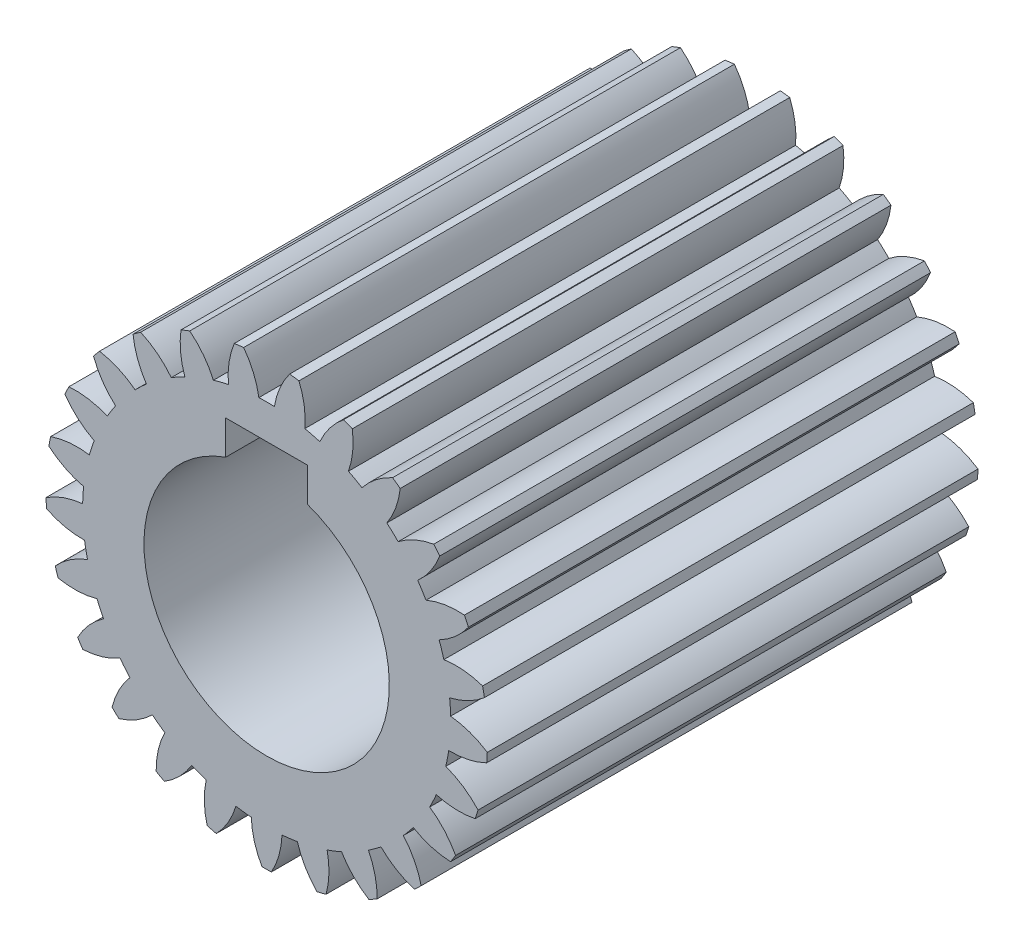
from build123d import *

# Parameters (mm, degrees)
EXTRUDE_1_DEPTH = 60


with BuildPart() as part:
    # Model → 凸台-拉伸1 (new body)
    with BuildSketch(Plane.XY):
        with BuildLine():
            ThreePointArc((-26.623667603, 4.492251481), (-24.628342026, 3.167806143), (-22.375329871, 2.355761908))
            ThreePointArc((-22.375329871, 2.355761908), (-22.454603363, 1.412723899), (-22.494148969, 0.467186424))
            ThreePointArc((-22.494148969, 0.467186424), (-24.83117158, -0.056077302), (-26.976760436, -1.119998387))
            ThreePointArc((-26.976760436, -1.119998387), (-26.946721668, -1.695344027), (-26.904413642, -2.269917752))
            ThreePointArc((-26.904413642, -2.269917752), (-24.642398725, -3.056535912), (-22.258221901, -3.282766946))
            ThreePointArc((-22.258221901, -3.282766946), (-22.100480854, -4.215892197), (-21.903638454, -5.141558466))
            ThreePointArc((-21.903638454, -5.141558466), (-24.037108806, -6.229576789), (-25.850703628, -7.793659087))
            ThreePointArc((-25.850703628, -7.793659087), (-25.67852594, -8.343458848), (-25.494656424, -8.889459704))
            ThreePointArc((-25.494656424, -8.889459704), (-23.108082884, -9.088824574), (-20.742547988, -8.715027478))
            ThreePointArc((-20.742547988, -8.715027478), (-20.357703853, -9.579608281), (-19.93684178, -10.427240328))
            ThreePointArc((-19.93684178, -10.427240328), (-21.732706083, -12.011649055), (-23.100352038, -13.977615523))
            ThreePointArc((-23.100352038, -13.977615523), (-22.796853989, -14.467323464), (-22.48297618, -14.95044421))
            ThreePointArc((-22.48297618, -14.95044421), (-20.12180121, -14.550028962), (-17.9235435, -13.599690783))
            ThreePointArc((-17.9235435, -13.599690783), (-17.335777449, -14.341402345), (-16.717340013, -15.057740331))
            ThreePointArc((-16.717340013, -15.057740331), (-18.06275751, -17.038985236), (-18.898520373, -19.28330697))
            ThreePointArc((-18.898520373, -19.28330697), (-18.48277186, -19.68215294), (-18.058607856, -20.072037323))
            ThreePointArc((-18.058607856, -20.072037323), (-15.871192762, -19.097001519), (-13.978336856, -17.6298355))
            ThreePointArc((-13.978336856, -17.6298355), (-13.224580391, -18.202073356), (-12.447426292, -18.742107131))
            ThreePointArc((-12.447426292, -18.742107131), (-13.257859452, -20.995699309), (-13.509225169, -23.377357322))
            ThreePointArc((-13.509225169, -23.377357322), (-13.007349201, -23.660280361), (-12.499550786, -23.932430511))
            ThreePointArc((-12.499550786, -23.932430511), (-10.623338904, -22.444039237), (-9.154819898, -20.552232814))
            ThreePointArc((-9.154819898, -20.552232814), (-8.282434311, -20.919041156), (-7.395394998, -21.248838411))
            ThreePointArc((-7.395394998, -21.248838411), (-7.619921326, -23.633176378), (-7.271095664, -26.002522336))
            ThreePointArc((-7.271095664, -26.002522336), (-6.714626953, -26.15174535), (-6.15510097, -26.289061072))
            ThreePointArc((-6.15510097, -26.289061072), (-4.707981592, -24.380835426), (-3.756071937, -22.183257755))
            ThreePointArc((-3.756071937, -22.183257755), (-2.819872422, -22.321588665), (-1.878683838, -22.420427026))
            ThreePointArc((-1.878683838, -22.420427026), (-1.503195518, -24.785694058), (-0.576096477, -26.993853242))
            ThreePointArc((-0.576096477, -26.993853242), (0, -27), (0.576096477, -26.993853242))
            ThreePointArc((0.576096477, -26.993853242), (1.503195518, -24.785694058), (1.878683838, -22.420427026))
            ThreePointArc((1.878683838, -22.420427026), (2.819872422, -22.321588665), (3.756071937, -22.183257755))
            ThreePointArc((3.756071937, -22.183257755), (4.707981592, -24.380835426), (6.15510097, -26.289061072))
            ThreePointArc((6.15510097, -26.289061072), (6.714626953, -26.15174535), (7.271095664, -26.002522336))
            ThreePointArc((7.271095664, -26.002522336), (7.619921325, -23.633176378), (7.395394998, -21.248838411))
            ThreePointArc((7.395394998, -21.248838411), (8.282434311, -20.919041156), (9.154819898, -20.552232814))
            ThreePointArc((9.154819898, -20.552232814), (10.623338904, -22.444039237), (12.499550786, -23.932430511))
            ThreePointArc((12.499550786, -23.932430511), (13.007349201, -23.660280361), (13.509225169, -23.377357322))
            ThreePointArc((13.509225169, -23.377357322), (13.257859452, -20.995699309), (12.447426292, -18.742107131))
            ThreePointArc((12.447426292, -18.742107131), (13.224580391, -18.202073356), (13.978336856, -17.6298355))
            ThreePointArc((13.978336856, -17.6298355), (15.871192762, -19.097001519), (18.058607856, -20.072037323))
            ThreePointArc((18.058607856, -20.072037323), (18.48277186, -19.68215294), (18.898520373, -19.28330697))
            ThreePointArc((18.898520373, -19.28330697), (18.06275751, -17.038985236), (16.717340013, -15.057740331))
            ThreePointArc((16.717340013, -15.057740331), (17.335777449, -14.341402345), (17.9235435, -13.599690783))
            ThreePointArc((17.9235435, -13.599690783), (20.12180121, -14.550028962), (22.48297618, -14.95044421))
            ThreePointArc((22.48297618, -14.95044421), (22.796853989, -14.467323464), (23.100352038, -13.977615523))
            ThreePointArc((23.100352038, -13.977615523), (21.732706083, -12.011649055), (19.93684178, -10.427240328))
            ThreePointArc((19.93684178, -10.427240328), (20.357703853, -9.579608281), (20.742547988, -8.715027478))
            ThreePointArc((20.742547988, -8.715027478), (23.108082884, -9.088824574), (25.494656424, -8.889459704))
            ThreePointArc((25.494656424, -8.889459704), (25.67852594, -8.343458848), (25.850703628, -7.793659087))
            ThreePointArc((25.850703628, -7.793659087), (24.037108806, -6.229576789), (21.903638454, -5.141558466))
            ThreePointArc((21.903638454, -5.141558466), (22.100480854, -4.215892197), (22.258221901, -3.282766946))
            ThreePointArc((22.258221901, -3.282766946), (24.642398725, -3.056535912), (26.904413642, -2.269917752))
            ThreePointArc((26.904413642, -2.269917752), (26.946721668, -1.695344027), (26.976760436, -1.119998387))
            ThreePointArc((26.976760436, -1.119998387), (24.83117158, -0.056077302), (22.494148969, 0.467186424))
            ThreePointArc((22.494148969, 0.467186424), (22.454603363, 1.412723899), (22.375329871, 2.355761907))
            ThreePointArc((22.375329871, 2.355761907), (24.628342026, 3.167806143), (26.623667603, 4.492251481))
            ThreePointArc((26.623667603, 4.492251481), (26.52175577, 5.059295494), (26.407768172, 5.624035931))
            ThreePointArc((26.407768172, 5.624035931), (24.065000522, 6.120945728), (21.671269376, 6.046576272))
            ThreePointArc((21.671269376, 6.046576272), (21.39782056, 6.952573356), (21.086513575, 7.846269576))
            ThreePointArc((21.086513575, 7.846269576), (23.066796021, 9.193103287), (24.670058614, 10.972156033))
            ThreePointArc((24.670058614, 10.972156033), (24.430330417, 11.496040872), (24.179478714, 12.014691387))
            ThreePointArc((24.179478714, 12.014691387), (21.786736975, 11.913367227), (19.486704228, 11.246037495))
            ThreePointArc((19.486704228, 11.246037495), (18.996533996, 12.05556706), (18.47275408, 12.843767271))
            ThreePointArc((18.47275408, 12.843767271), (20.055878388, 14.640763942), (21.166339111, 16.762639667))
            ThreePointArc((21.166339111, 16.762639667), (20.803857555, 17.210447723), (20.431903681, 17.650419597))
            ThreePointArc((20.431903681, 17.650419597), (18.139532619, 16.957228049), (16.077717785, 15.738868823))
            ThreePointArc((16.077717785, 15.738868823), (15.401625336, 16.401065148), (14.698283508, 17.034243832))
            ThreePointArc((14.698283508, 17.034243832), (15.784776155, 19.168491554), (16.332660679, 21.499865003))
            ThreePointArc((16.332660679, 21.499865003), (15.870201812, 21.843458848), (15.400516998, 22.17710703))
            ThreePointArc((15.400516998, 22.17710703), (13.352554715, 20.935603868), (11.658509204, 19.242769139))
            ThreePointArc((11.658509204, 19.242769139), (10.838975914, 19.716023994), (10.000265727, 20.154396205))
            ThreePointArc((10.000265727, 20.154396205), (10.521858385, 22.491792344), (10.472741108, 24.88617475))
            ThreePointArc((10.472741108, 24.88617475), (9.939362922, 25.103965119), (9.401459192, 25.310325266))
            ThreePointArc((9.401459192, 25.310325266), (7.726586692, 23.5985187), (6.506753613, 21.5375755))
            ThreePointArc((6.506753613, 21.5375755), (5.595273771, 21.792152542), (4.673894472, 22.008173742))
            ThreePointArc((4.673894472, 22.008173742), (4.597813555, 24.401851103), (3.954780698, 26.708794612))
            ThreePointArc((3.954780698, 26.708794612), (3.383997306, 26.787096935), (2.811673129, 26.853202681))
            ThreePointArc((2.811673129, 26.853202681), (1.61512881, 24.778651813), (0.946154762, 22.479096783))
            ThreePointArc((0.946154762, 22.479096783), (0, 22.499), (-0.946154762, 22.479096783))
            ThreePointArc((-0.946154762, 22.479096783), (-1.61512881, 24.778651813), (-2.811673129, 26.853202681))
            ThreePointArc((-2.811673129, 26.853202681), (-3.383997306, 26.787096935), (-3.954780698, 26.708794612))
            ThreePointArc((-3.954780698, 26.708794612), (-4.597813555, 24.401851103), (-4.673894472, 22.008173742))
            ThreePointArc((-4.673894472, 22.008173742), (-5.595273771, 21.792152542), (-6.506753613, 21.5375755))
            ThreePointArc((-6.506753613, 21.5375755), (-7.726586692, 23.5985187), (-9.401459192, 25.310325266))
            ThreePointArc((-9.401459192, 25.310325266), (-9.939362922, 25.103965119), (-10.472741108, 24.88617475))
            ThreePointArc((-10.472741108, 24.88617475), (-10.521858385, 22.491792344), (-10.000265727, 20.154396205))
            ThreePointArc((-10.000265727, 20.154396205), (-10.838975914, 19.716023994), (-11.658509204, 19.242769139))
            ThreePointArc((-11.658509204, 19.242769139), (-13.352554715, 20.935603868), (-15.400516998, 22.17710703))
            ThreePointArc((-15.400516998, 22.17710703), (-15.870201812, 21.843458848), (-16.332660679, 21.499865003))
            ThreePointArc((-16.332660679, 21.499865003), (-15.784776155, 19.168491554), (-14.698283508, 17.034243832))
            ThreePointArc((-14.698283508, 17.034243832), (-15.401625336, 16.401065148), (-16.077717785, 15.738868823))
            ThreePointArc((-16.077717785, 15.738868823), (-18.139532619, 16.957228049), (-20.431903682, 17.650419597))
            ThreePointArc((-20.431903682, 17.650419597), (-20.803857555, 17.210447723), (-21.166339111, 16.762639667))
            ThreePointArc((-21.166339111, 16.762639667), (-20.055878388, 14.640763942), (-18.47275408, 12.843767271))
            ThreePointArc((-18.47275408, 12.843767271), (-18.996533996, 12.05556706), (-19.486704227, 11.246037495))
            ThreePointArc((-19.486704227, 11.246037495), (-21.786736975, 11.913367227), (-24.179478714, 12.014691387))
            ThreePointArc((-24.179478714, 12.014691387), (-24.430330417, 11.496040872), (-24.670058614, 10.972156033))
            ThreePointArc((-24.670058614, 10.972156033), (-23.066796021, 9.193103287), (-21.086513575, 7.846269576))
            ThreePointArc((-21.086513575, 7.846269576), (-21.39782056, 6.952573356), (-21.671269376, 6.046576272))
            ThreePointArc((-21.671269376, 6.046576272), (-24.065000522, 6.120945728), (-26.407768172, 5.624035931))
            ThreePointArc((-26.407768172, 5.624035931), (-26.52175577, 5.059295494), (-26.623667603, 4.492251481))
        make_face()
        with BuildLine():
            Line((5, 14.142135624), (5, 18.3))
            Line((5, 18.3), (-5, 18.3))
            Line((-5, 18.3), (-5, 14.142135624))
            ThreePointArc((-5, 14.142135624), (0, -15), (5, 14.142135624))
        make_face(mode=Mode.SUBTRACT)
    extrude(amount=EXTRUDE_1_DEPTH)


solid = part.part
